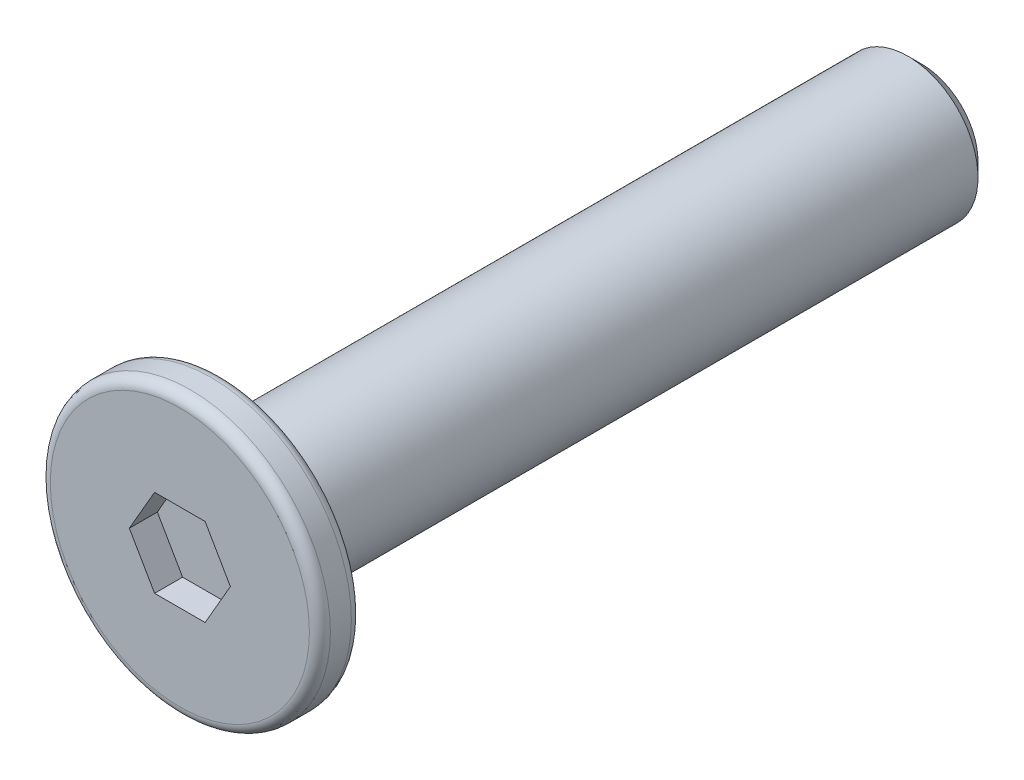
from build123d import *

# Parameters (mm, degrees)
SKETCH_1_R          = 4
EXTRUDE_1_DEPTH     = 0.6
SKETCH_2_R          = 2
EXTRUDE_2_DEPTH     = 20
CHAMFER_1_SIZE      = 0.4
CUT_EXTRUDE_1_DEPTH = 0.8
FILLET_2_R          = 0.3


with BuildPart() as part:
    # 草图1 → 凸台-拉伸1 (new, symmetric)
    with BuildSketch(Plane.XY):
        Circle(SKETCH_1_R)
    extrude(amount=EXTRUDE_1_DEPTH, both=True)

    # 草图2 → 凸台-拉伸2 (add)
    with BuildSketch(Plane(origin=(0, 0, -0.6), x_dir=(-1, 0, 0), z_dir=(0, 0, -1))):
        Circle(SKETCH_2_R)
    extrude(amount=EXTRUDE_2_DEPTH)

    # 倒角1
    chamfer_1_edges = [part.edges().sort_by_distance(p)[0] for p in [
        (2, 0, -20.6),
    ]]
    chamfer(chamfer_1_edges, length=CHAMFER_1_SIZE)

    # 草图3 → 切除-拉伸1 (cut)
    with BuildSketch(Plane.XY.offset(0.6)):
        Polygon((1.443375673, 0), (0.721687836, 1.25), (-0.721687836, 1.25), (-1.443375673, 0), (-0.721687836, -1.25), (0.721687836, -1.25), align=None)
    extrude(amount=-CUT_EXTRUDE_1_DEPTH, mode=Mode.SUBTRACT)

    # 圆角2
    fillet_2_edges = [part.edges().sort_by_distance(p)[0] for p in [
        (-4, 0, -0.6),
        (-4, 0, 0.6),
    ]]
    fillet(fillet_2_edges, radius=FILLET_2_R)


solid = part.part
